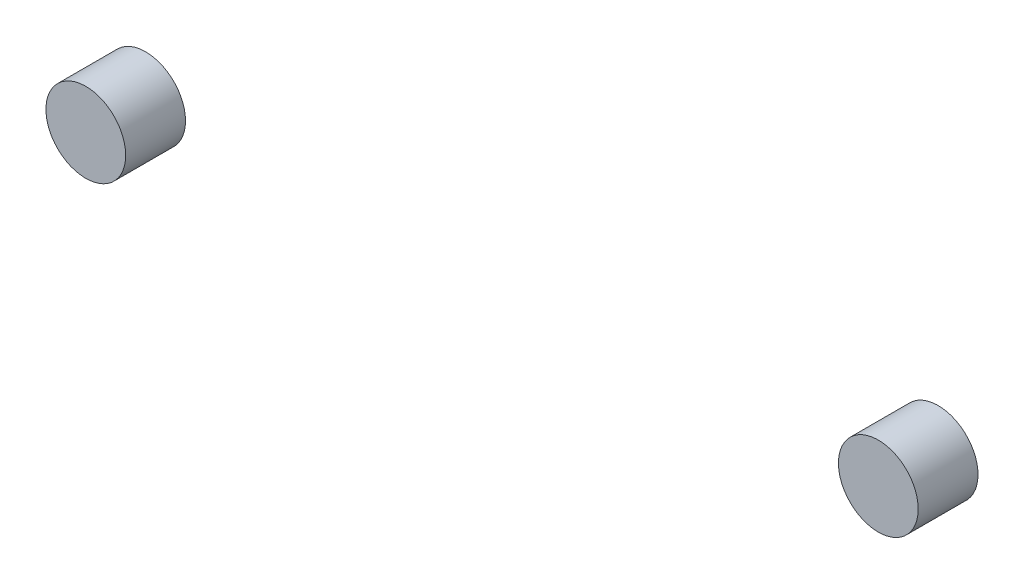
from build123d import *

# Parameters (mm, degrees)
SKETCH_1_R        = 1
EXTRUDE_1_DEPTH   = 1.5
EXTRUDE_1_2_DEPTH = 1.5


with BuildPart() as part:
    # 草图1 → 凸台-拉伸1 (new body)
    with BuildSketch(Plane.XY):
        with Locations((19.872483498, 2.254861332)):
            Circle(SKETCH_1_R)
    extrude(amount=EXTRUDE_1_DEPTH)


with BuildPart() as body_2:
    # 草图1 → Extrude 1 2 (new body)
    with BuildSketch(Plane.XY):
        Circle(SKETCH_1_R)
    extrude(amount=EXTRUDE_1_2_DEPTH)


solid = Compound([part.part, body_2.part])
